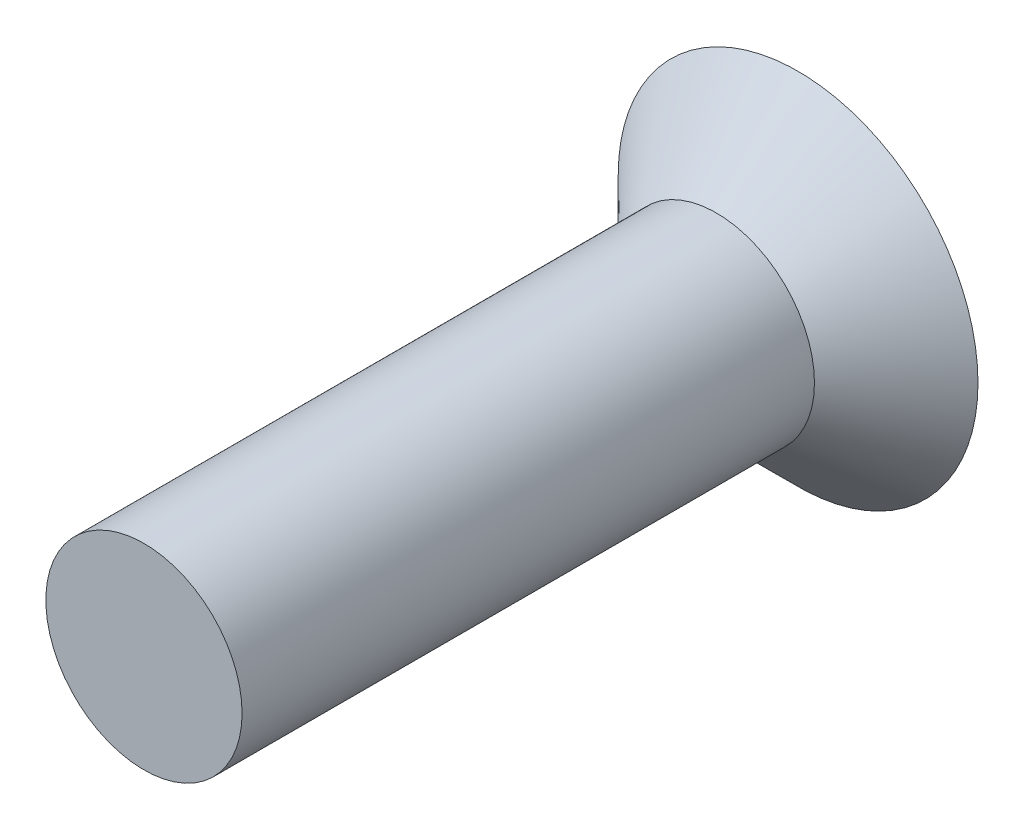
from build123d import *

# Parameters (mm, degrees)
M3_55MM_START    = 1.25
SKETCH_1_R       = 1.5
M3_55MM_DEPTH    = 8.75
SKETCH_2_R       = 2.75
M3_D5P5_90_DEPTH = 1.25
M3_D5P5_90_TAPER = 45


with BuildPart() as part:
    # 草图1 → M3简化螺杆_沉头总长55mm (new body)
    with BuildSketch(Plane.XY.offset(M3_55MM_START)):
        Circle(SKETCH_1_R)
    extrude(amount=M3_55MM_DEPTH)

    # 草图2 → M3沉头_D5p5_90度 (add)
    with BuildSketch(Plane.XY):
        Circle(SKETCH_2_R)
    extrude(amount=M3_D5P5_90_DEPTH, taper=M3_D5P5_90_TAPER)


solid = part.part
